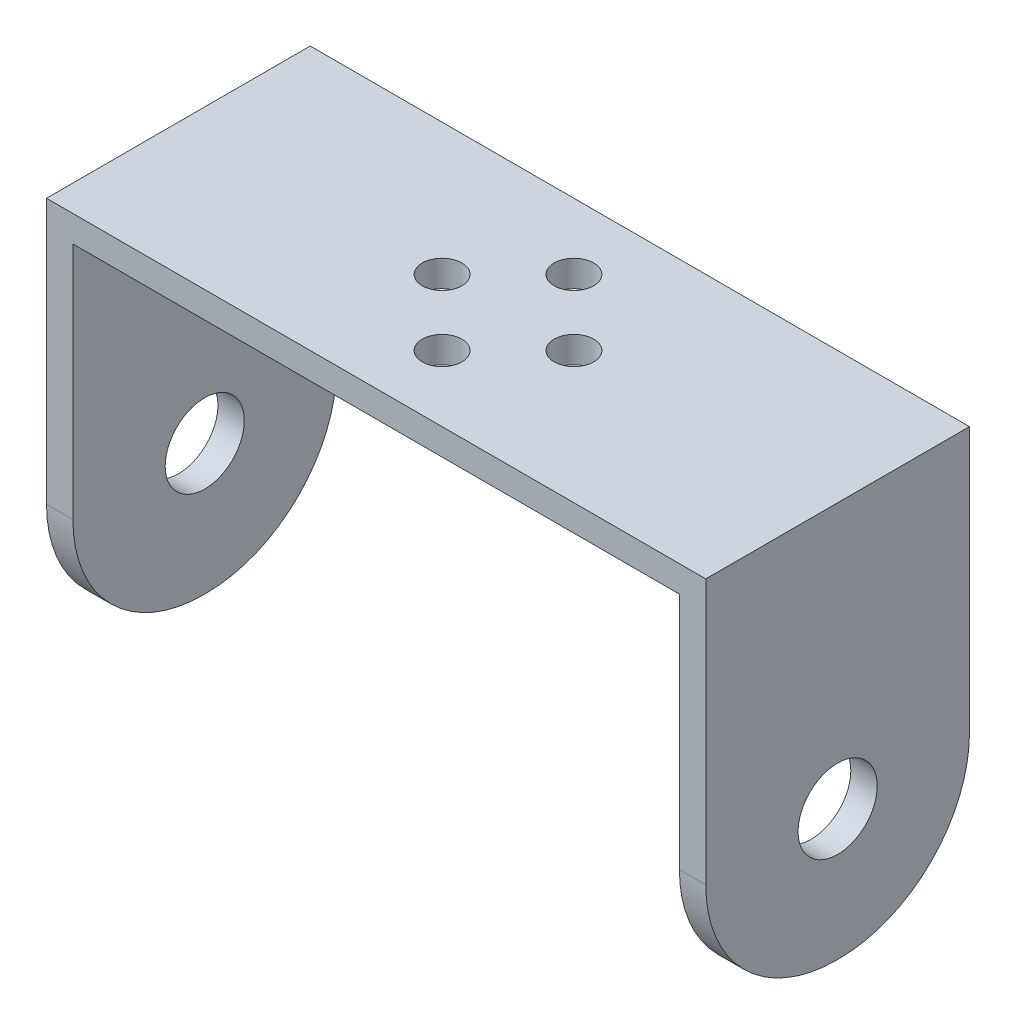
from build123d import *

# Parameters (mm, degrees)
SKETCH_1_W          = 50
SKETCH_1_H          = 20
EXTRUDE_1_DEPTH     = 2
SKETCH_2_R          = 3
EXTRUDE_2_DEPTH     = 2
EXTRUDE_START       = -2
SKETCH_3_R          = 3
EXTRUDE_3_DEPTH     = 2
SKETCH_4_R          = 1.5
CUT_EXTRUDE_1_DEPTH = 2


with BuildPart() as part:
    # 草图1 → 凸台-拉伸1 (new body)
    with BuildSketch(Plane(origin=(0, 0, 0), x_dir=(1, 0, 0), z_dir=(0, 1, 0))):
        Rectangle(SKETCH_1_W, SKETCH_1_H)
    extrude(amount=EXTRUDE_1_DEPTH)

    # 草图2 → 凸台-拉伸2 (add)
    with BuildSketch(Plane.ZY.offset(25)):
        with BuildLine():
            Line((-10, 2), (10, 2))
            Line((10, 2), (10, -18.1))
            ThreePointArc((10, -18.1), (7.100357134, -25.100357134), (0.1, -28))
            Line((0.1, -28), (-0.1, -28))
            ThreePointArc((-0.1, -28), (-7.100357134, -25.100357134), (-10, -18.1))
            Line((-10, -18.1), (-10, 2))
        make_face()
        with Locations((0, -18.1)):
            Circle(SKETCH_2_R, mode=Mode.SUBTRACT)
    extrude(amount=-EXTRUDE_2_DEPTH)

    # 草图3 → 凸台-拉伸3 (add)
    with BuildSketch(Plane(origin=(25, 0, 0), x_dir=(0, 0, -1), z_dir=(1, 0, 0)).offset(EXTRUDE_START)):
        with BuildLine():
            Line((-10, 2), (10, 2))
            Line((10, 2), (10, -18.1))
            ThreePointArc((10, -18.1), (7.100357134, -25.100357134), (0.1, -28))
            Line((0.1, -28), (-0.1, -28))
            ThreePointArc((-0.1, -28), (-7.100357134, -25.100357134), (-10, -18.1))
            Line((-10, -18.1), (-10, 2))
        make_face()
        with Locations(Location((0, -18.1, 0), (0, 0, 180))):
            Circle(SKETCH_3_R, mode=Mode.SUBTRACT)
    extrude(amount=EXTRUDE_3_DEPTH)

    # 草图4 → 切除-拉伸1 (cut)
    with BuildSketch(Plane(origin=(0, 2, 0), x_dir=(1, 0, 0), z_dir=(0, 1, 0))):
        with Locations(Location((0, 5, 0), (0, 0, 270))):
            Circle(SKETCH_4_R)
        with Locations(Location((5, 0, 0), (0, 0, 270))):
            Circle(SKETCH_4_R)
        with Locations(Location((0, -5, 0), (0, 0, 270))):
            Circle(SKETCH_4_R)
        with Locations(Location((-5, 0, 0), (0, 0, 270))):
            Circle(SKETCH_4_R)
    extrude(amount=-CUT_EXTRUDE_1_DEPTH, mode=Mode.SUBTRACT)


solid = part.part
